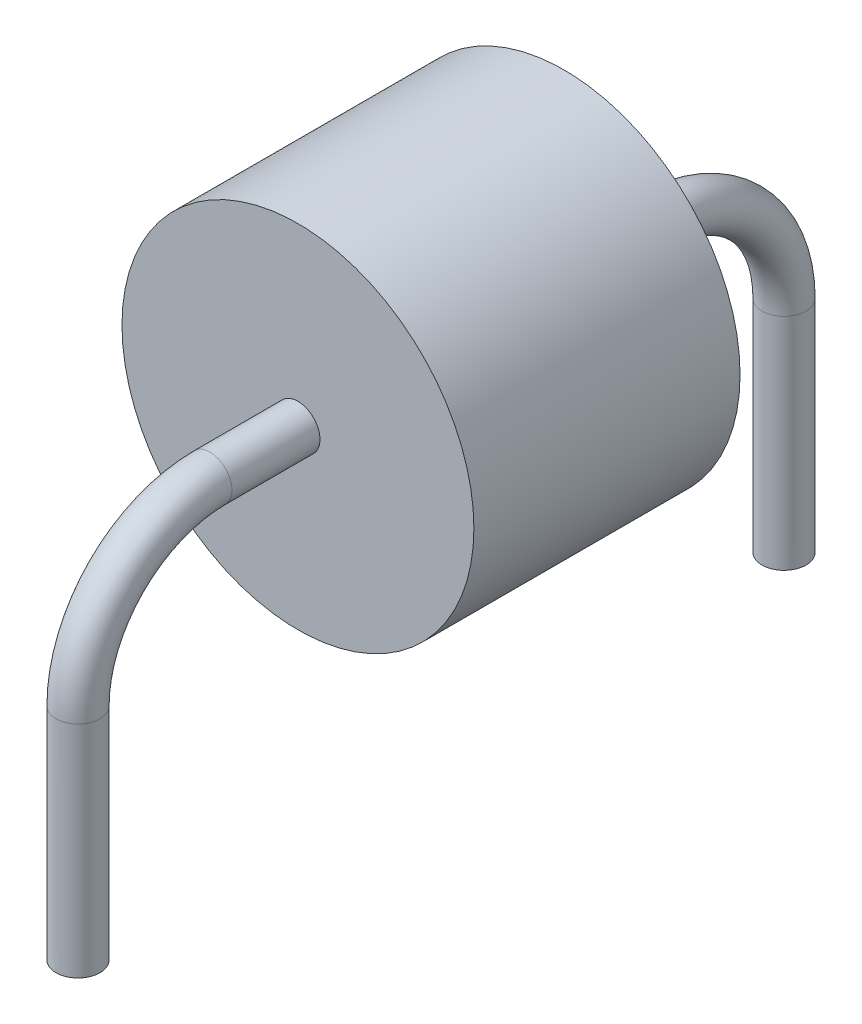
from build123d import *

# Parameters (mm, degrees)
SKETCH1_R           = 4
BOSS_EXTRUDE1_DEPTH = 3.025
SKETCH3_R           = 0.5


with BuildPart() as part:
    # Sketch1 → Boss-Extrude1 (new, symmetric)
    with BuildSketch(Plane.XY):
        Circle(SKETCH1_R)
    extrude(amount=BOSS_EXTRUDE1_DEPTH, both=True)

    # Sweep1: sweep along a path in Sketch2
    with BuildLine(Plane(origin=(0, 0, 0), x_dir=(0, 0, -1), z_dir=(1, 0, 0))) as sweep1_path:
        Line((-3.025, 0), (-5.025, 0))
        ThreePointArc((-5.025, 0), (-7.146320344, -0.878679656), (-8.025, -3))
        Line((-8.025, -3), (-8.025, -8))
    # Sketch3 → Sweep1 (sweep)
    with BuildSketch(Plane.XY.offset(3.025)):
        Circle(SKETCH3_R)
    sweep1 = sweep(path=sweep1_path.line)

    # Mirror1: Sweep1 across plane
    add(sweep1.mirror(Plane.XY))


solid = part.part
